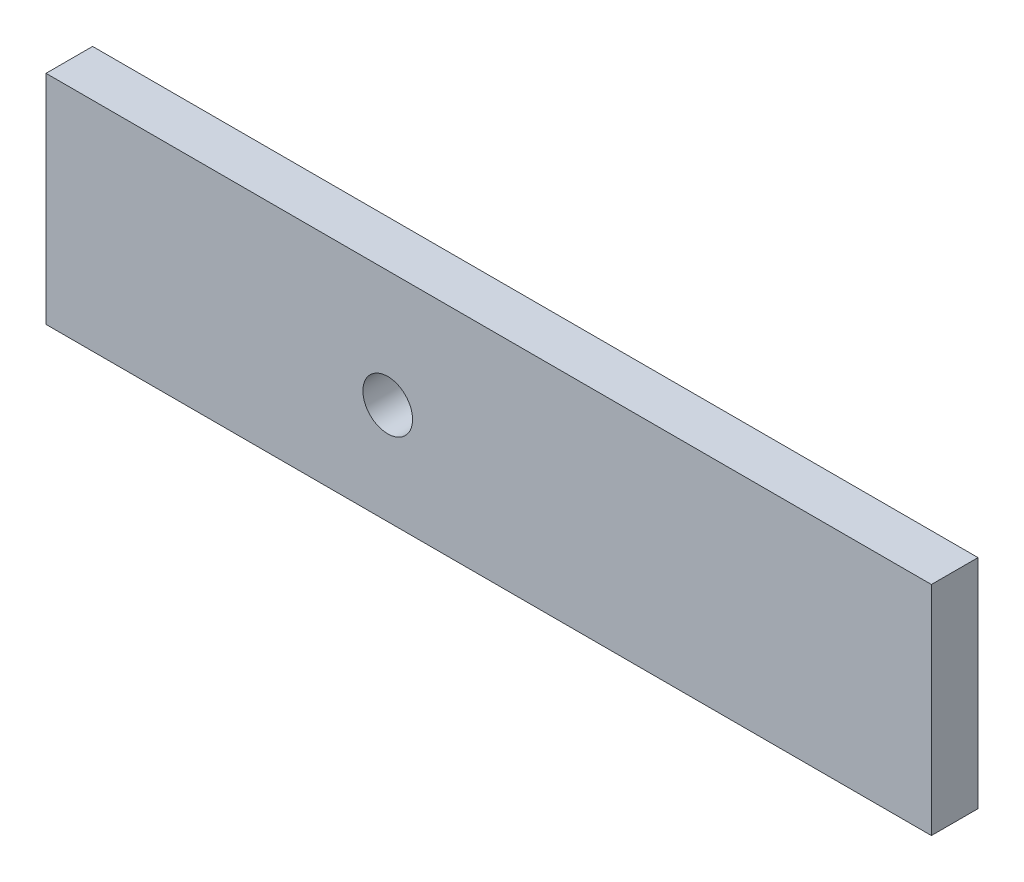
from build123d import *

# Parameters (mm, degrees)
SKETCH_1_W         = 28.5
SKETCH_1_H         = 7
BASE_DEPTH         = 1.5
SKETCH_4_R         = 0.725
AXIS_DEPTH         = 1.9
HOLE_WIZARD_M2_1_D = 1.6


with BuildPart() as part:
    # 草图1 → base (new body)
    with BuildSketch(Plane.XY):
        with Locations((3.85, 4.3)):
            Rectangle(SKETCH_1_W, SKETCH_1_H)
    extrude(amount=BASE_DEPTH)

    # 草图4 → axis (add)
    with BuildSketch(Plane(origin=(0, 0, 0), x_dir=(-1, 0, 0), z_dir=(0, 0, -1))):
        with Locations(Location((-11.1, 3.3, 0), (0, 0, 270))):
            Circle(SKETCH_4_R)
    extrude(amount=AXIS_DEPTH)

    # M2 螺纹孔的螺纹孔钻头1 (through all)
    with Locations(Plane(origin=(0.6, 4.05, 0), x_dir=(-1, 0, 0), z_dir=(0, 0, -1))):
        with Locations((0, 0)):
            Hole(HOLE_WIZARD_M2_1_D / 2)


solid = part.part
